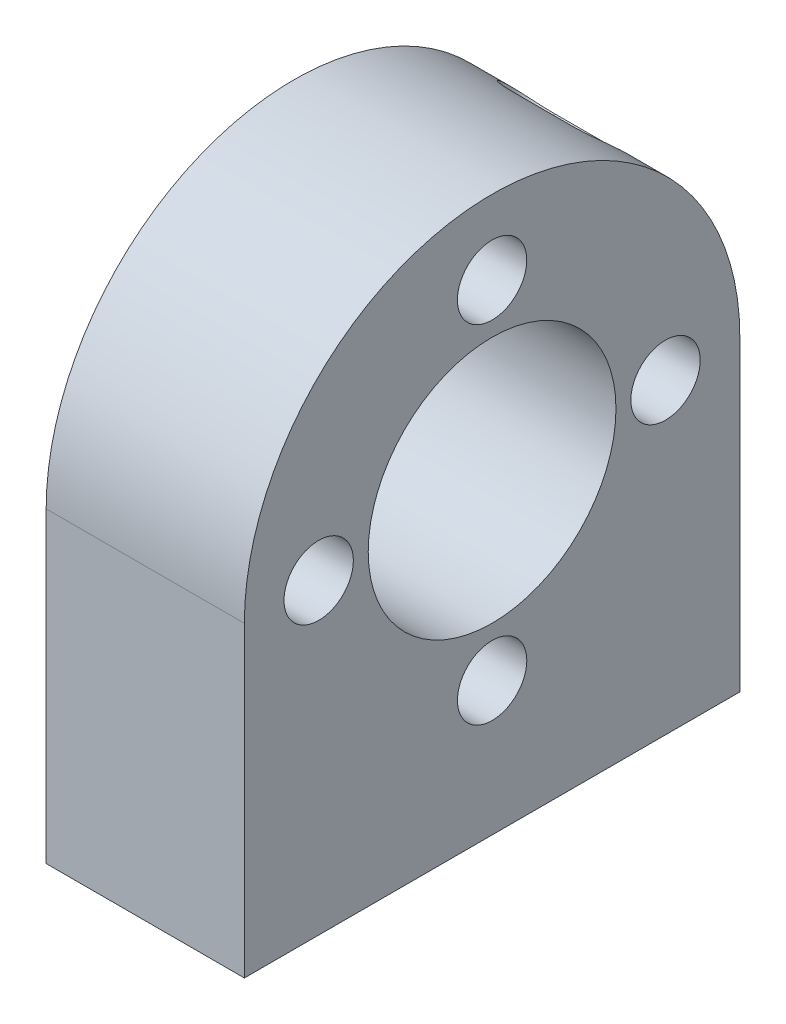
from build123d import *

# Parameters (mm, degrees)
SKIZZE1_W                       = 20
SKIZZE1_H                       = 50
AUFSATZ_LINEAR_AUSTRAGEN1_DEPTH = 56
SKIZZE2_R                       = 12.5
SKIZZE2_R_2                     = 2
SCHNITT_LINEAR_AUSTRAGEN1_DEPTH = 65.505813691
SKIZZE3_R                       = 1.65
SCHNITT_LINEAR_AUSTRAGEN2_DEPTH = 15
SKIZZE6_R                       = 3.5
SCHNITT_LINEAR_AUSTRAGEN5_DEPTH = 10
CUT_EXTRUDE1_DEPTH              = 17


with BuildPart() as part:
    # Skizze1 → Aufsatz-Linear austragen1 (new body)
    with BuildSketch(Plane(origin=(0, 0, 0), x_dir=(1, 0, 0), z_dir=(0, 1, 0))):
        Rectangle(SKIZZE1_W, SKIZZE1_H)
    extrude(amount=AUFSATZ_LINEAR_AUSTRAGEN1_DEPTH)

    # Skizze2 → Schnitt-Linear austragen1 (cut, through all)
    with BuildSketch(Plane.ZY.offset(10)):
        with BuildLine():
            Line((-25, 56), (-25, 31))
            ThreePointArc((-25, 31), (-17.677669509, 48.67766955), (5.8e-08, 56))
            Line((5.8e-08, 56), (-25, 56))
        make_face()
        with BuildLine():
            ThreePointArc((5.8e-08, 56), (17.67766955, 48.677669509), (25, 31))
            Line((25, 31), (25, 56))
            Line((25, 56), (5.8e-08, 56))
        make_face()
        with Locations((0, 31)):
            Circle(SKIZZE2_R)
        with Locations((17.5, 31)):
            Circle(SKIZZE2_R_2)
        with Locations((0, 48.5)):
            Circle(SKIZZE2_R_2)
        with Locations((0, 13.5)):
            Circle(SKIZZE2_R_2)
        with Locations((-17.5, 31)):
            Circle(SKIZZE2_R_2)
    extrude(amount=-SCHNITT_LINEAR_AUSTRAGEN1_DEPTH, mode=Mode.SUBTRACT)

    # Skizze3 → Schnitt-Linear austragen2 (cut)
    with BuildSketch(Plane.XZ):
        with Locations(Location((0, 19, 0), (0, 0, 270))):
            Circle(SKIZZE3_R)
        with Locations(Location((0, 9, 0), (0, 0, 270))):
            Circle(SKIZZE3_R)
        with Locations(Location((0, -9, 0), (0, 0, 90))):
            Circle(SKIZZE3_R)
        with Locations(Location((0, -19, 0), (0, 0, 90))):
            Circle(SKIZZE3_R)
    extrude(amount=-SCHNITT_LINEAR_AUSTRAGEN2_DEPTH, mode=Mode.SUBTRACT)

    # Skizze6 → Schnitt-Linear austragen5 (cut)
    with BuildSketch(Plane(origin=(10, 0, 0), x_dir=(0, 0, -1), z_dir=(1, 0, 0))):
        with Locations((17.5, 31)):
            Circle(SKIZZE6_R)
        with Locations((0.001666066, 13.498333934)):
            Circle(SKIZZE6_R)
        with Locations((-17.5, 30.996667867)):
            Circle(SKIZZE6_R)
        with Locations((-0.001666066, 48.498333934)):
            Circle(SKIZZE6_R)
    extrude(amount=-SCHNITT_LINEAR_AUSTRAGEN5_DEPTH, mode=Mode.SUBTRACT)

    # Sketch1 → Cut-Extrude1 (cut)
    with BuildSketch(Plane(origin=(0, 33.17766953, -33.17766953), x_dir=(-1, 0, 0), z_dir=(0, 0.7071067811865537, -0.7071067811865414))):
        with BuildLine():
            Line((-3, 25.5), (3, 25.5))
            ThreePointArc((3, 25.5), (6, 22.5), (3, 19.5))
            Line((3, 19.5), (-3, 19.5))
            ThreePointArc((-3, 19.5), (-6, 22.5), (-3, 25.5))
        make_face()
    extrude(amount=-CUT_EXTRUDE1_DEPTH, mode=Mode.SUBTRACT)


solid = part.part
